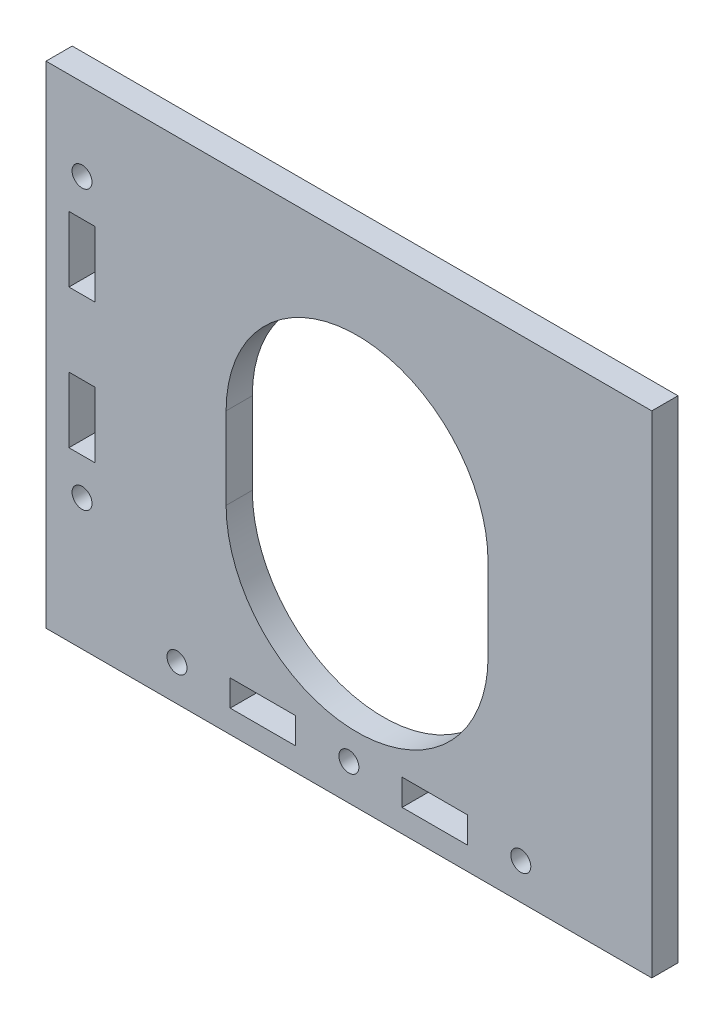
from build123d import *

# Parameters (mm, degrees)
MODEL_W             = 185
MODEL_H             = 150
MODEL_R             = 3.05
MODEL_W_2           = 20
MODEL_H_2           = 8
MODEL_W_3           = 8
MODEL_H_3           = 20
BOSS_EXTRUDE1_DEPTH = 8


with BuildPart() as part:
    # Model → Boss-Extrude1 (new body)
    with BuildSketch(Plane.XY):
        with Locations((77.5, 60)):
            Rectangle(MODEL_W, MODEL_H)
        with Locations((77.5, -4)):
            Circle(MODEL_R, mode=Mode.SUBTRACT)
        with Locations((-4, 110)):
            Circle(MODEL_R, mode=Mode.SUBTRACT)
        with Locations((-4, 25)):
            Circle(MODEL_R, mode=Mode.SUBTRACT)
        with Locations((25, -4)):
            Circle(MODEL_R, mode=Mode.SUBTRACT)
        with Locations((130, -4)):
            Circle(MODEL_R, mode=Mode.SUBTRACT)
        with Locations((51.25, -4)):
            Rectangle(MODEL_W_2, MODEL_H_2, mode=Mode.SUBTRACT)
        with Locations((103.75, -4)):
            Rectangle(MODEL_W_2, MODEL_H_2, mode=Mode.SUBTRACT)
        with BuildLine():
            Line((40, 45), (40, 70))
            ThreePointArc((40, 70), (80, 110), (120, 70))
            Line((120, 70), (120, 45))
            ThreePointArc((120, 45), (80, 5), (40, 45))
        make_face(mode=Mode.SUBTRACT)
        with Locations((-4, 88.75)):
            Rectangle(MODEL_W_3, MODEL_H_3, mode=Mode.SUBTRACT)
        with Locations((-4, 46.25)):
            Rectangle(MODEL_W_3, MODEL_H_3, mode=Mode.SUBTRACT)
    extrude(amount=BOSS_EXTRUDE1_DEPTH)


solid = part.part
